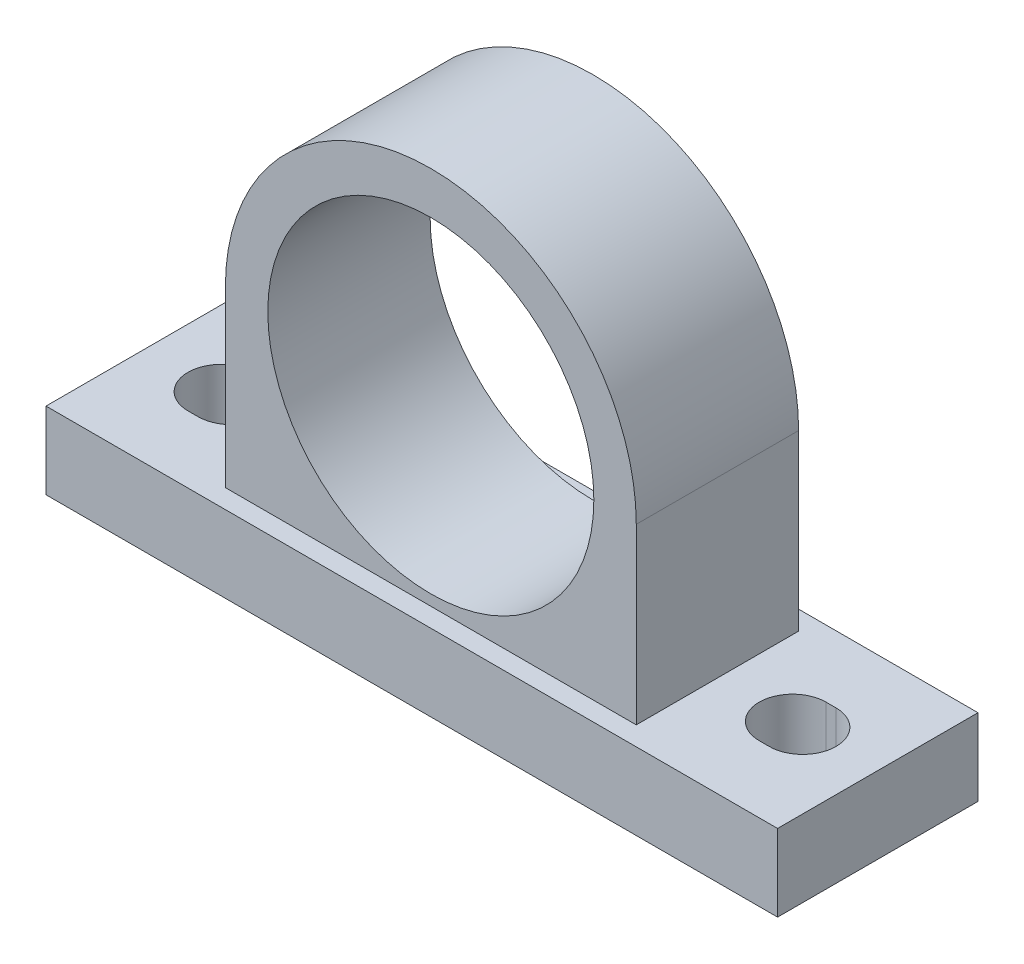
from build123d import *

# Parameters (mm, degrees)
SKETCH1_W           = 218.9988
SKETCH1_H           = 59.99988
BOSS_EXTRUDE1_DEPTH = 11.49985
CUT_EXTRUDE1_DEPTH  = 22.9997
SKETCH3_R           = 48.80102
BOSS_EXTRUDE2_DEPTH = 24.30018


with BuildPart() as part:
    # Sketch1 → Boss-Extrude1 (new, symmetric)
    with BuildSketch(Plane(origin=(0, 0, 0), x_dir=(1, 0, 0), z_dir=(0, 1, 0))):
        Rectangle(SKETCH1_W, SKETCH1_H)
    extrude(amount=BOSS_EXTRUDE1_DEPTH, both=True)

    # Sketch2 → Cut-Extrude1 (cut)
    with BuildSketch(Plane(origin=(0, 11.49985, 0), x_dir=(1, 0, 0), z_dir=(0, 1, 0))):
        with BuildLine():
            Line((-87.00135, 9.99998), (-84.00161, 9.99998))
            ThreePointArc((-84.00161, 9.99998), (-74.00163, 0), (-84.00161, -9.99998))
            Line((-84.00161, -9.99998), (-87.00135, -9.99998))
            ThreePointArc((-87.00135, -9.99998), (-97.00133, 0), (-87.00135, 9.99998))
        make_face()
        with BuildLine():
            Line((87.00135, 9.99998), (84.00161, 9.99998))
            ThreePointArc((84.00161, 9.99998), (74.00163, 0), (84.00161, -9.99998))
            Line((84.00161, -9.99998), (87.00135, -9.99998))
            ThreePointArc((87.00135, -9.99998), (97.00133, 0), (87.00135, 9.99998))
        make_face()
    extrude(amount=-CUT_EXTRUDE1_DEPTH, mode=Mode.SUBTRACT)

    # Sketch3 → Boss-Extrude2 (add, symmetric)
    with BuildSketch(Plane.XY):
        with BuildLine():
            Line((-61.50102, 63.5), (-61.50102, 11.49985))
            Line((-61.50102, 11.49985), (61.50102, 11.49985))
            Line((61.50102, 11.49985), (61.50102, 63.5))
            ThreePointArc((61.50102, 63.5), (0, 125.00102), (-61.50102, 63.5))
        make_face()
        with Locations(Location((0, 63.5, 0), (0, 0, 180))):
            Circle(SKETCH3_R, mode=Mode.SUBTRACT)
    extrude(amount=BOSS_EXTRUDE2_DEPTH, both=True)


solid = part.part
